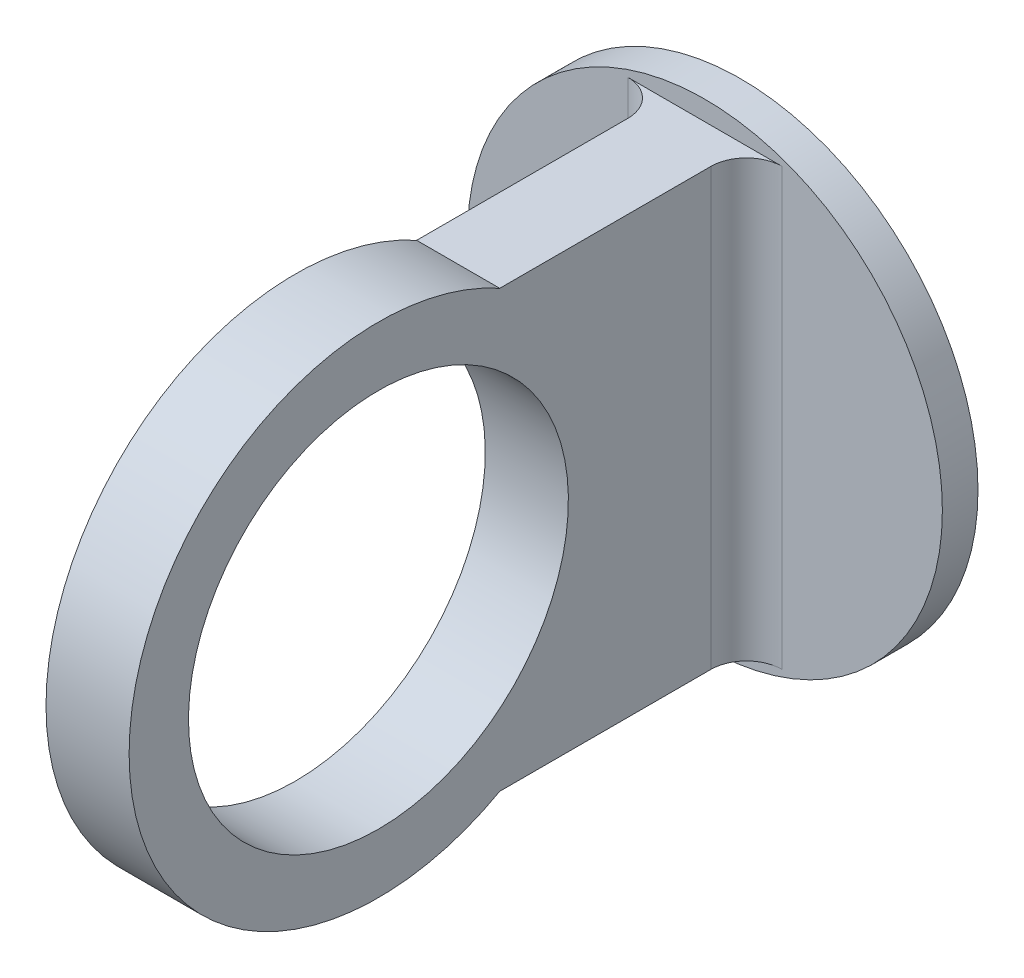
from build123d import *

# Parameters (mm, degrees)
SKETCH1_R           = 20
BOSS_EXTRUDE1_DEPTH = 3
SKETCH2_W           = 7
SKETCH2_H           = 36.693281072
BOSS_EXTRUDE2_DEPTH = 30
FILLET2_R           = 3
SKETCH3_R           = 21
SKETCH3_R_2         = 16
BOSS_EXTRUDE3_DEPTH = 7
SKETCH4_R           = 16
CUT_EXTRUDE1_DEPTH  = 7


with BuildPart() as part:
    # Sketch1 → Boss-Extrude1 (new body)
    with BuildSketch(Plane.XY):
        Circle(SKETCH1_R)
    extrude(amount=BOSS_EXTRUDE1_DEPTH)

    # Sketch2 → Boss-Extrude2 (add)
    with BuildSketch(Plane(origin=(0, 0, 0), x_dir=(-1, 0, 0), z_dir=(0, 0, -1))):
        Rectangle(SKETCH2_W, SKETCH2_H)
    extrude(amount=-BOSS_EXTRUDE2_DEPTH)

    # Fillet2
    fillet2_edges = [part.edges().sort_by_distance(p)[0] for p in [
        (3.5, 0, 3),
        (-3.5, 0, 3),
    ]]
    fillet(fillet2_edges, radius=FILLET2_R)

    # Sketch3 → Boss-Extrude3 (add)
    with BuildSketch(Plane.ZY.offset(3.5)):
        with Locations((34, 0)):
            Circle(SKETCH3_R)
        with Locations((34, 0)):
            Circle(SKETCH3_R_2, mode=Mode.SUBTRACT)
    extrude(amount=-BOSS_EXTRUDE3_DEPTH)

    # Sketch4 → Cut-Extrude1 (cut)
    with BuildSketch(Plane.ZY.offset(3.5)):
        with Locations(Location((34, 0, 0), (0, 0, 270))):
            Circle(SKETCH4_R)
    extrude(amount=-CUT_EXTRUDE1_DEPTH, mode=Mode.SUBTRACT)


solid = part.part
